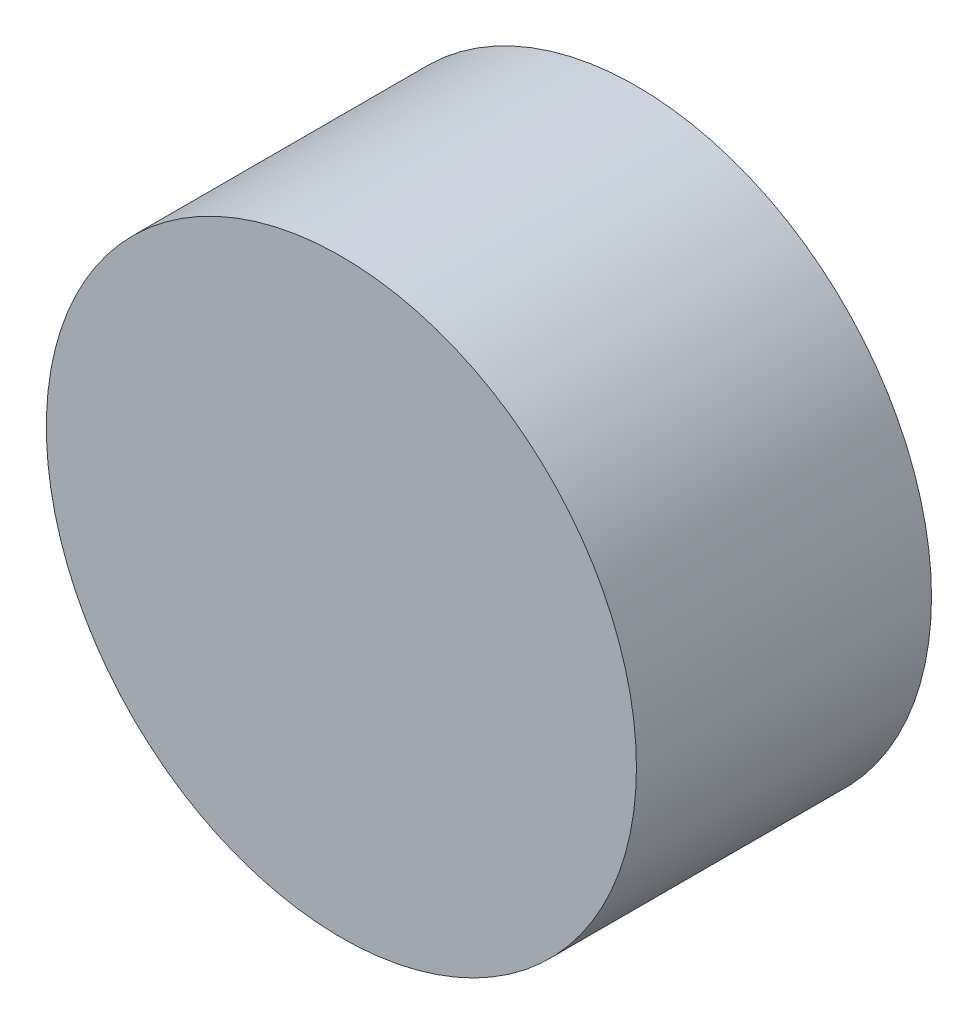
from build123d import *

# Parameters (mm, degrees)
SKETCH_1_R      = 8
EXTRUDE_1_DEPTH = 8


with BuildPart() as part:
    # 草图1 → 凸台-拉伸1 (new body)
    with BuildSketch(Plane.XY):
        Circle(SKETCH_1_R)
    extrude(amount=EXTRUDE_1_DEPTH)


solid = part.part
